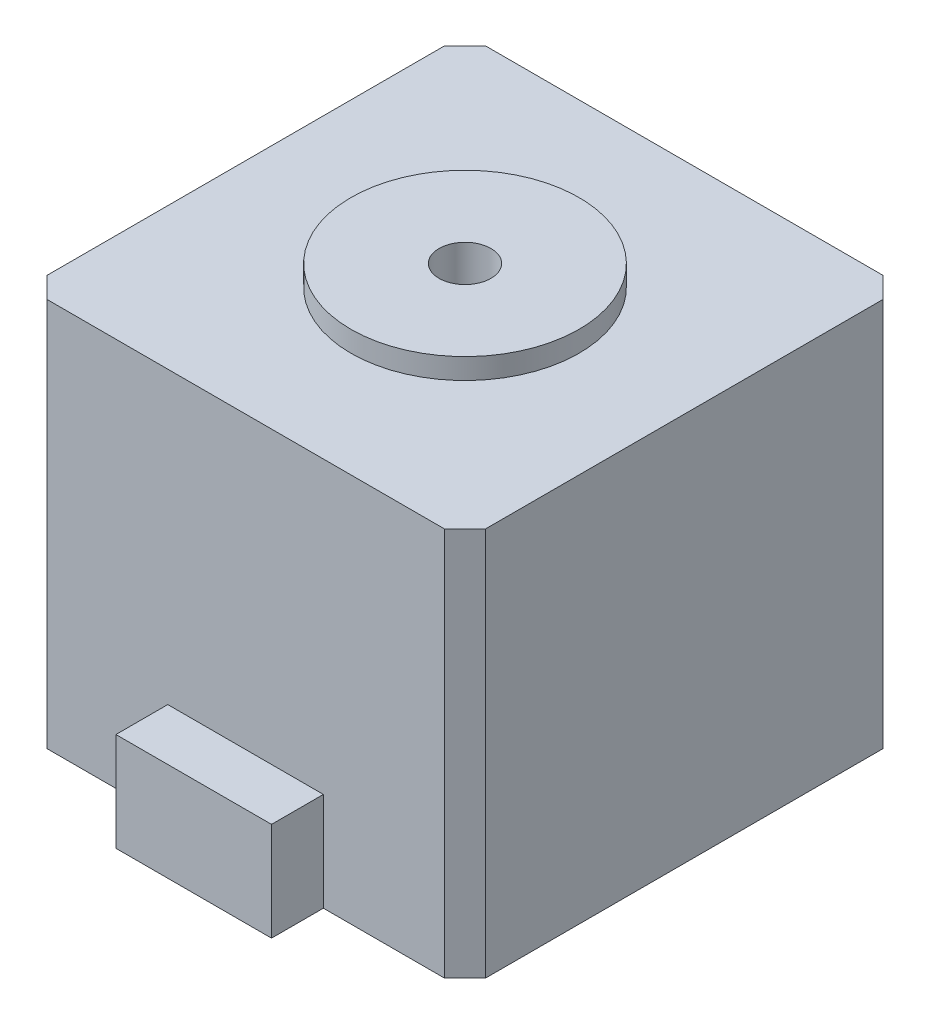
from build123d import *

# Parameters (mm, degrees)
SKETCH1_W           = 42.3
SKETCH1_H           = 42.3
BOSS_EXTRUDE1_DEPTH = 37.5
CHAMFER2_SIZE       = 2
SKETCH2_R           = 11
BOSS_EXTRUDE2_DEPTH = 2
SKETCH3_R           = 2.5
CUT_EXTRUDE2_DEPTH  = 20
SKETCH5_W           = 15
SKETCH5_H           = 9.5
BOSS_EXTRUDE4_DEPTH = 5


with BuildPart() as part:
    # Sketch1 → Boss-Extrude1 (new body)
    with BuildSketch(Plane(origin=(0, 0, 0), x_dir=(1, 0, 0), z_dir=(0, 1, 0))):
        with Locations((21.15, 21.15)):
            Rectangle(SKETCH1_W, SKETCH1_H)
    extrude(amount=BOSS_EXTRUDE1_DEPTH)

    # Chamfer2
    chamfer2_edges = [part.edges().sort_by_distance(p)[0] for p in [
        (0, 18.75, -42.3),
        (42.3, 18.75, -42.3),
        (42.3, 18.75, 0),
        (0, 18.75, 0),
    ]]
    chamfer(chamfer2_edges, length=CHAMFER2_SIZE)

    # Sketch2 → Boss-Extrude2 (add)
    with BuildSketch(Plane(origin=(0, 37.5, 0), x_dir=(1, 0, 0), z_dir=(0, 1, 0))):
        with Locations(Location((21.15, 21.15, 0), (0, 0, 270))):
            Circle(SKETCH2_R)
    extrude(amount=BOSS_EXTRUDE2_DEPTH)

    # Sketch3 → Cut-Extrude2 (cut)
    with BuildSketch(Plane(origin=(0, 39.5, 0), x_dir=(1, 0, 0), z_dir=(0, 1, 0))):
        with Locations(Location((21.15, 21.15, 0), (0, 0, 270))):
            Circle(SKETCH3_R)
    extrude(amount=-CUT_EXTRUDE2_DEPTH, mode=Mode.SUBTRACT)

    # Sketch5 → Boss-Extrude4 (add)
    with BuildSketch(Plane.XY):
        with Locations((21.15, 4.75)):
            Rectangle(SKETCH5_W, SKETCH5_H)
    extrude(amount=BOSS_EXTRUDE4_DEPTH)


solid = part.part
